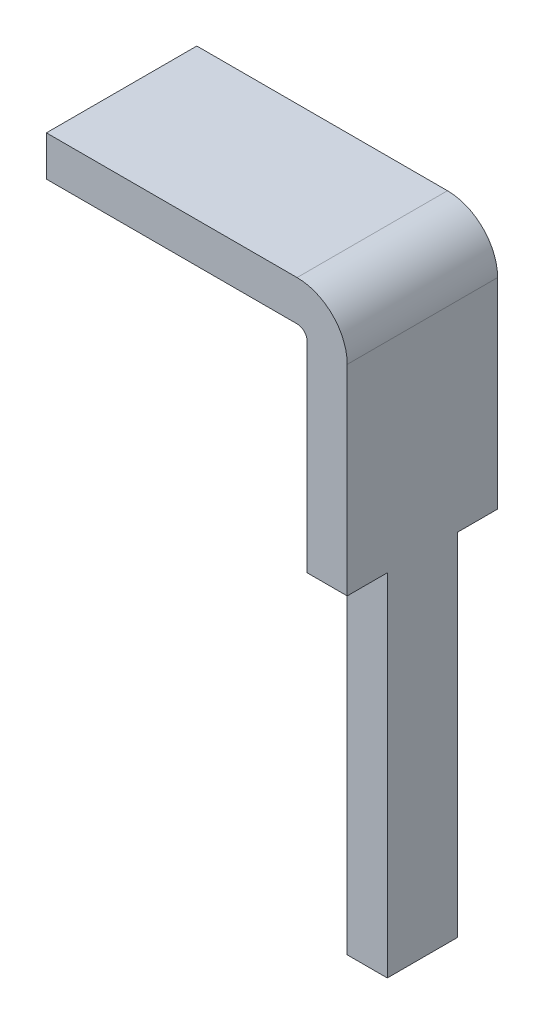
from build123d import *

# Parameters (mm, degrees)
BOSS_EXTRUDE1_DEPTH = 1.5
CUT_EXTRUDE1_REACH  = 8.874
SKETCH2_W           = 0.4
SKETCH2_H           = 3.5


with BuildPart() as part:
    # Sketch1 → Boss-Extrude1 (new body)
    with BuildSketch(Plane.XY):
        with BuildLine():
            Line((0, 0), (2.5, 0))
            ThreePointArc((2.5, 0), (2.853553391, -0.146446609), (3, -0.5))
            Line((3, -0.5), (3, -6))
            Line((3, -6), (2.6, -6))
            Line((2.6, -6), (2.6, -0.5))
            ThreePointArc((2.6, -0.5), (2.570710678, -0.429289322), (2.5, -0.4))
            Line((2.5, -0.4), (0, -0.4))
            Line((0, -0.4), (0, 0))
        make_face()
    extrude(amount=BOSS_EXTRUDE1_DEPTH)

    # Sketch2 → Cut-Extrude1 (cut, up to next)
    with BuildSketch(Plane(origin=(3, 0, 0), x_dir=(0, 0, -1), z_dir=(1, 0, 0)), mode=Mode.PRIVATE) as cut_extrude1_sk1:
        with Locations((-0.2, -4.25)):
            Rectangle(SKETCH2_W, SKETCH2_H)
    cut_extrude1_tool1 = extrude(cut_extrude1_sk1.sketch, amount=-CUT_EXTRUDE1_REACH, mode=Mode.PRIVATE) & part.part
    # Sketch2 → Cut-Extrude1 (cut, up to next)
    with BuildSketch(Plane(origin=(3, 0, 0), x_dir=(0, 0, -1), z_dir=(1, 0, 0)), mode=Mode.PRIVATE) as cut_extrude1_sk2:
        with Locations((-1.3, -4.25)):
            Rectangle(SKETCH2_W, SKETCH2_H)
    cut_extrude1_tool2 = extrude(cut_extrude1_sk2.sketch, amount=-CUT_EXTRUDE1_REACH, mode=Mode.PRIVATE) & part.part
    add(cut_extrude1_tool1.solids().sort_by_distance((3, -4.25, 0.2))[0], mode=Mode.SUBTRACT)
    add(cut_extrude1_tool2.solids().sort_by_distance((3, -4.25, 1.3))[0], mode=Mode.SUBTRACT)


solid = part.part
